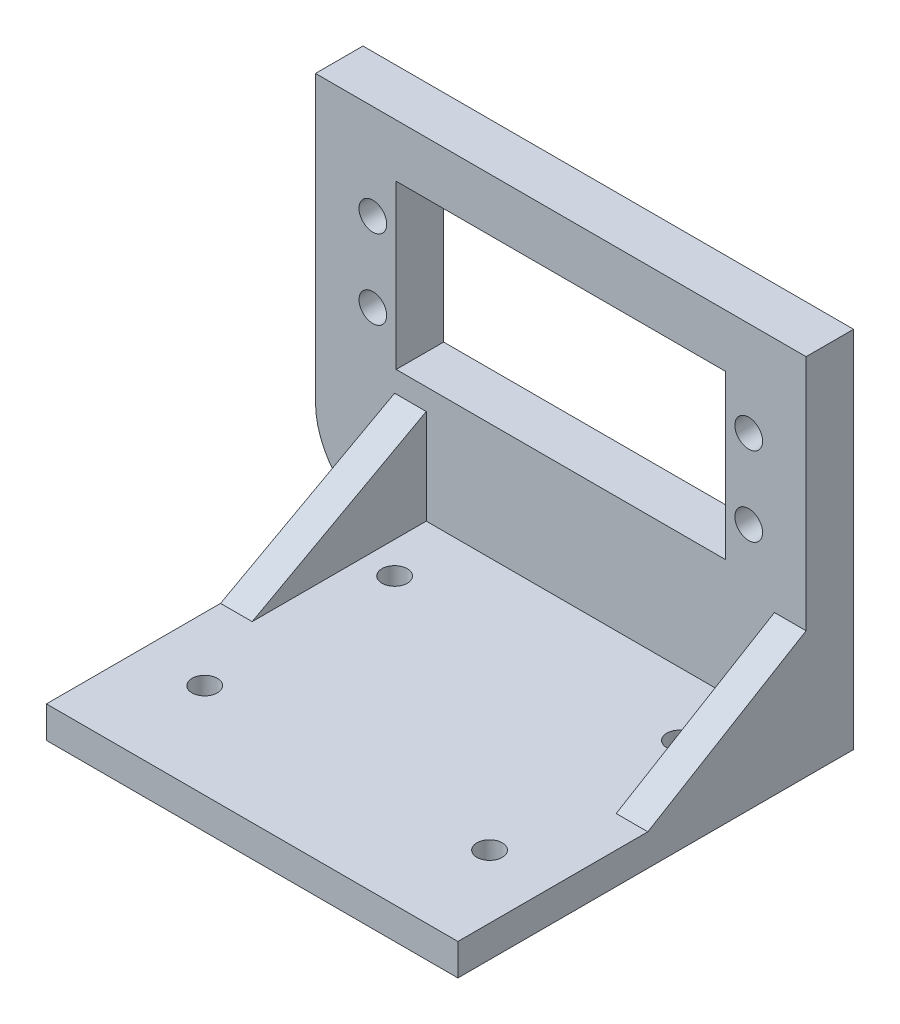
from build123d import *

# Parameters (mm, degrees)
SCHIZZO1_W                    = 62
SCHIZZO1_H                    = 6
ESTRUSIONE_ESTRUSIONE1_DEPTH  = 46
TAGLIO_ESTRUSIONE1_DEPTH      = 56.555261254
TAGLIO_ESTRUSIONE1_DEPTH_BACK = 56.555261254
SCHIZZO3_W                    = 41.6
SCHIZZO3_H                    = 20.6
SCHIZZO6_R                    = 1.75
TAGLIO_ESTRUSIONE2_DEPTH      = 56.794264938
SCHIZZO7_W                    = 52
SCHIZZO7_H                    = 4
ESTRUSIONE_ESTRUSIONE3_DEPTH  = 44
SCHIZZO10_R                   = 1.6
TAGLIO_ESTRUSIONE4_DEPTH      = 71.285162547
ESTRUSIONE_ESTRUSIONE4_DEPTH  = 4
ESTRUSIONE_ESTRUSIONE5_DEPTH  = 4
RACCORDO3_R                   = 10


with BuildPart() as part:
    # Schizzo1 → Estrusione-Estrusione1 (new body)
    with BuildSketch(Plane(origin=(0, 0, 0), x_dir=(1, 0, 0), z_dir=(0, 1, 0))):
        with Locations((0, -0.063829787)):
            Rectangle(SCHIZZO1_W, SCHIZZO1_H)
    extrude(amount=ESTRUSIONE_ESTRUSIONE1_DEPTH)

    # Schizzo3 → Taglio-Estrusione1 (cut, two sides: drawn at the far end of the back side and taken through both)
    with BuildSketch(Plane.XY.offset(-TAGLIO_ESTRUSIONE1_DEPTH_BACK)):
        with Locations((0, 29)):
            Rectangle(SCHIZZO3_W, SCHIZZO3_H)
    extrude(amount=TAGLIO_ESTRUSIONE1_DEPTH + TAGLIO_ESTRUSIONE1_DEPTH_BACK, mode=Mode.SUBTRACT)

    # Schizzo6 → Taglio-Estrusione2 (cut, through all)
    with BuildSketch(Plane.XY.offset(3.063829787)):
        with Locations((-23.75, 34)):
            Circle(SCHIZZO6_R)
        with Locations(Location((-23.75, 24, 0), (0, 0, 180))):
            Circle(SCHIZZO6_R)
        with Locations((23.75, 24)):
            Circle(SCHIZZO6_R)
        with Locations(Location((23.75, 34, 0), (0, 0, 180))):
            Circle(SCHIZZO6_R)
    extrude(amount=-TAGLIO_ESTRUSIONE2_DEPTH, mode=Mode.SUBTRACT)

    # Schizzo7 → Estrusione-Estrusione3 (add)
    with BuildSketch(Plane.XY.offset(3.063829787)):
        with Locations((5, 2)):
            Rectangle(SCHIZZO7_W, SCHIZZO7_H)
    extrude(amount=ESTRUSIONE_ESTRUSIONE3_DEPTH)

    # Schizzo10 → Taglio-Estrusione4 (cut, through all)
    with BuildSketch(Plane(origin=(0, 4, 0), x_dir=(1, 0, 0), z_dir=(0, 1, 0))):
        with Locations(Location((-13, -11.063829787, 0), (0, 0, 180))):
            Circle(SCHIZZO10_R)
        with Locations((-13, -35.063829787)):
            Circle(SCHIZZO10_R)
        with Locations(Location((23, -35.063829787, 0), (0, 0, 180))):
            Circle(SCHIZZO10_R)
        with Locations((23, -11.063829787)):
            Circle(SCHIZZO10_R)
    extrude(amount=-TAGLIO_ESTRUSIONE4_DEPTH, mode=Mode.SUBTRACT)

    # Schizzo13 → Estrusione-Estrusione4 (add)
    with BuildSketch(Plane(origin=(31, 0, 0), x_dir=(0, 0, -1), z_dir=(1, 0, 0))):
        Polygon((-23.063829787, 4), (-3.063829787, 16), (-3.063829787, 4), align=None)
    extrude(amount=-ESTRUSIONE_ESTRUSIONE4_DEPTH)

    # Schizzo15 → Estrusione-Estrusione5 (add)
    with BuildSketch(Plane.ZY.offset(21)):
        Polygon((25.063829787, 4), (3.063829787, 4), (3.063829787, 16), align=None)
    extrude(amount=-ESTRUSIONE_ESTRUSIONE5_DEPTH)

    # Raccordo3
    raccordo3_edges = [part.edges().sort_by_distance(p)[0] for p in [
        (-31, 0, 0.063829787),
    ]]
    fillet(raccordo3_edges, radius=RACCORDO3_R)


solid = part.part
